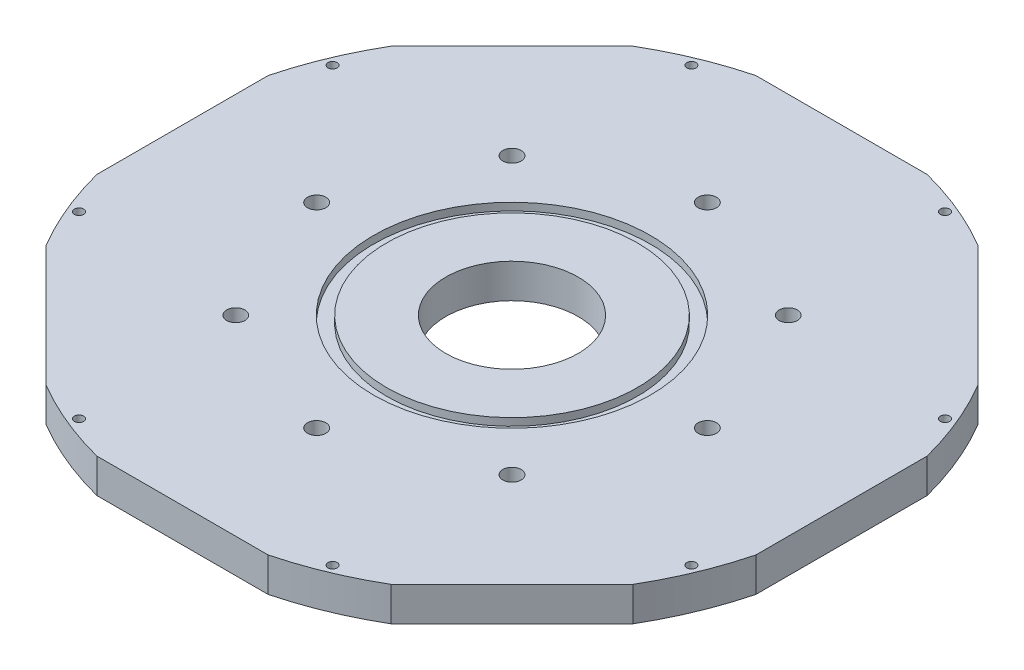
from build123d import *

# Parameters (mm, degrees)
BOSS_EXTRUDE1_DEPTH   = 12.7
SKETCH3_R             = 24.5745
CUT_EXTRUDE1_DEPTH    = 174.423960282
SKETCH5_R             = 51.3715
SKETCH5_R_2           = 46.5455
CUT_EXTRUDE2_DEPTH    = 2.794
SKETCH37_R            = 119.0625
SKETCH37_R_2          = 115.2525
CUT_EXTRUDE7_DEPTH    = 2.667
CIRPATTERN4_COUNT     = 8
F_8_32_TAPPED_HOLE1_D = 3.4544
CIRPATTERN5_COUNT     = 8


with BuildPart() as part:
    # Sketch1 → Boss-Extrude1 (new body)
    with BuildSketch(Plane(origin=(0, 0, 0), x_dir=(1, 0, 0), z_dir=(0, 1, 0))):
        with BuildLine():
            ThreePointArc((-31.793446259, 122.3), (-48.357791931, 116.746037126), (-63.997797892, 108.960520786))
            Line((-63.997797892, 108.960520786), (-108.960520786, 63.997797892))
            ThreePointArc((-108.960520786, 63.997797892), (-116.746037126, 48.357791931), (-122.3, 31.793446259))
            Line((-122.3, 31.793446259), (-122.3, -31.793446259))
            ThreePointArc((-122.3, -31.793446259), (-116.746037126, -48.357791931), (-108.960520786, -63.997797892))
            Line((-108.960520786, -63.997797892), (-63.997797892, -108.960520786))
            ThreePointArc((-63.997797892, -108.960520786), (-48.357791931, -116.746037126), (-31.793446259, -122.3))
            Line((-31.793446259, -122.3), (31.793446259, -122.3))
            ThreePointArc((31.793446259, -122.3), (48.357791931, -116.746037126), (63.997797892, -108.960520786))
            Line((63.997797892, -108.960520786), (108.960520786, -63.997797892))
            ThreePointArc((108.960520786, -63.997797892), (116.746037126, -48.357791931), (122.3, -31.793446259))
            Line((122.3, -31.793446259), (122.3, 31.793446259))
            ThreePointArc((122.3, 31.793446259), (116.746037126, 48.357791931), (108.960520786, 63.997797892))
            Line((108.960520786, 63.997797892), (63.997797892, 108.960520786))
            ThreePointArc((63.997797892, 108.960520786), (48.357791931, 116.746037126), (31.793446259, 122.3))
            Line((31.793446259, 122.3), (-31.793446259, 122.3))
        make_face()
    extrude(amount=BOSS_EXTRUDE1_DEPTH)

    # Sketch3 → Cut-Extrude1 (cut, through all)
    with BuildSketch(Plane(origin=(0, 12.7, 0), x_dir=(1, 0, 0), z_dir=(0, 1, 0))):
        with Locations(Location((0, 0, 0), (0, 0, 270))):
            Circle(SKETCH3_R)
    extrude(amount=-CUT_EXTRUDE1_DEPTH, mode=Mode.SUBTRACT)

    # Sketch5 → Cut-Extrude2 (cut)
    with BuildSketch(Plane(origin=(0, 12.7, 0), x_dir=(1, 0, 0), z_dir=(0, 1, 0))):
        with Locations(Location((0, 0, 0), (0, 0, 270))):
            Circle(SKETCH5_R)
        with Locations(Location((0, 0, 0), (0, 0, 270))):
            Circle(SKETCH5_R_2, mode=Mode.SUBTRACT)
    extrude(amount=-CUT_EXTRUDE2_DEPTH, mode=Mode.SUBTRACT)

    # Sketch23 → M8x1.25 Tapped Hole1 (revolve, cut)
    with BuildSketch(Plane(origin=(-72.5, 12.7, 0), x_dir=(0, 0, 1), z_dir=(1, 0, 0))):
        Polygon((0, 0), (0, 8.392926105), (3.4, 6.35), (3.4, 0), align=None)
    m8x1_25_tapped_hole1 = revolve(axis=Axis((-72.5, 19.05, 0), (0, -1, 0)), mode=Mode.SUBTRACT)

    # Sketch37 → Cut-Extrude7 (cut)
    with BuildSketch(Plane.XZ):
        with Locations(Location((0, 0, 0), (0, 0, 270))):
            Circle(SKETCH37_R)
        with Locations(Location((0, 0, 0), (0, 0, 270))):
            Circle(SKETCH37_R_2, mode=Mode.SUBTRACT)
    extrude(amount=-CUT_EXTRUDE7_DEPTH, mode=Mode.SUBTRACT)

    # CirPattern4: M8x1.25 Tapped Hole1 ×8 about axis
    cirpattern4_axis = Axis((0, 0, 0), (0, 1, 0))
    for i in range(1, CIRPATTERN4_COUNT):
        add(m8x1_25_tapped_hole1.rotate(cirpattern4_axis, i * 360 / CIRPATTERN4_COUNT), mode=Mode.SUBTRACT)

    # #8-32 Tapped Hole1 (through all)
    with Locations(Plane(origin=(0, 12.7, 0), x_dir=(1, 0, 0), z_dir=(0, 1, 0))):
        with Locations((-47.069870839, 113.636720559)):
            f_8_32_tapped_hole1 = Hole(F_8_32_TAPPED_HOLE1_D / 2)

    # CirPattern5: #8-32 Tapped Hole1 ×8 about axis
    cirpattern5_axis = Axis((0, 0, 0), (0, 1, 0))
    for i in range(1, CIRPATTERN5_COUNT):
        add(f_8_32_tapped_hole1.rotate(cirpattern5_axis, i * 360 / CIRPATTERN5_COUNT), mode=Mode.SUBTRACT)


solid = part.part
